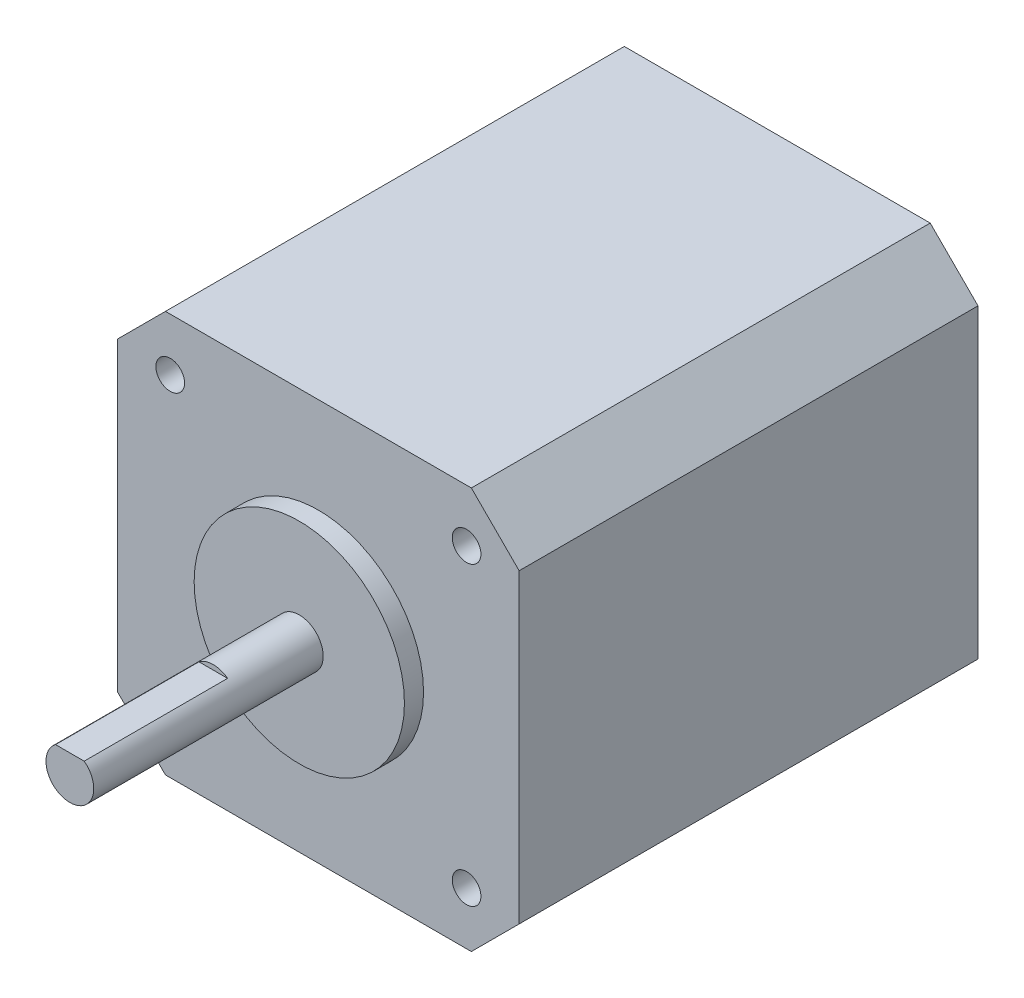
from build123d import *

# Parameters (mm, degrees)
BOSS_EXTRUDE1_DEPTH = 48
SKETCH1_3_R         = 11
BOSS_EXTRUDE2_DEPTH = 2
BOSS_EXTRUDE3_DEPTH = 26
BOSS_EXTRUDE4_DEPTH = 11
SKETCH1_6_R         = 1.5
CUT_EXTRUDE1_DEPTH  = 5


with BuildPart() as part:
    # Sketch1 → Boss-Extrude1 (new body)
    with BuildSketch(Plane.XY):
        Polygon((-16, -21), (16, -21), (21, -16), (21, 16), (16, 21), (-16, 21), (-21, 16), (-21, -16), align=None)
    extrude(amount=-BOSS_EXTRUDE1_DEPTH)

    # Sketch1<3> → Boss-Extrude2 (add)
    with BuildSketch(Plane.XY):
        Circle(SKETCH1_3_R)
        with BuildLine():
            ThreePointArc((2.5, 0), (-1.118033989, -2.236067977), (-1.5, 2))
            ThreePointArc((-1.5, 2), (0, 2.5), (1.5, 2))
            ThreePointArc((1.5, 2), (2.236067977, 1.118033989), (2.5, 0))
        make_face(mode=Mode.SUBTRACT)
    extrude(amount=BOSS_EXTRUDE2_DEPTH)

    # Sketch1<4> → Boss-Extrude3 (add)
    with BuildSketch(Plane.XY):
        with BuildLine():
            Line((1.5, 2), (-1.5, 2))
            ThreePointArc((-1.5, 2), (-1.118033989, -2.236067977), (2.5, 0))
            ThreePointArc((2.5, 0), (2.236067977, 1.118033989), (1.5, 2))
        make_face()
    extrude(amount=BOSS_EXTRUDE3_DEPTH)

    # Sketch1<5> → Boss-Extrude4 (add)
    with BuildSketch(Plane.XY):
        with BuildLine():
            ThreePointArc((1.5, 2), (0, 2.5), (-1.5, 2))
            Line((-1.5, 2), (1.5, 2))
        make_face()
    extrude(amount=BOSS_EXTRUDE4_DEPTH)

    # Sketch1<6> → Cut-Extrude1 (cut)
    with BuildSketch(Plane.XY):
        with Locations((-15.5, 15.5)):
            Circle(SKETCH1_6_R)
        with Locations((15.5, 15.5)):
            Circle(SKETCH1_6_R)
        with Locations((-15.5, -15.5)):
            Circle(SKETCH1_6_R)
        with Locations((15.5, -15.5)):
            Circle(SKETCH1_6_R)
    extrude(amount=-CUT_EXTRUDE1_DEPTH, mode=Mode.SUBTRACT)


solid = part.part
